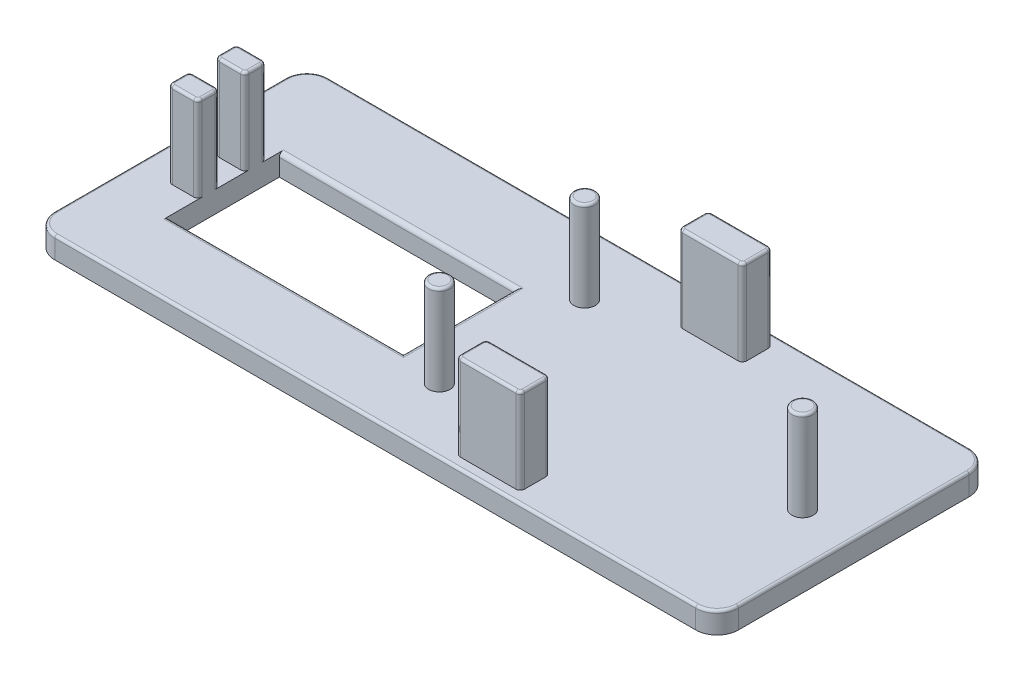
from build123d import *

# Parameters (mm, degrees)
SKETCH3_R             = 1.25
BOSS_EXTRUDE1_DEPTH   = 10.5
BOSS_EXTRUDE1_2_DEPTH = 10.5
BOSS_EXTRUDE1_3_DEPTH = 10.5
BOSS_EXTRUDE2_DEPTH   = 10
BOSS_EXTRUDE2_2_DEPTH = 10
BOSS_EXTRUDE2_3_DEPTH = 10
BOSS_EXTRUDE2_4_DEPTH = 10
BOSS_EXTRUDE3_DEPTH   = 2.5
FILLET1_R             = 0.3
SKETCH9_W             = 27.536120899
SKETCH9_H             = 13
CUT_EXTRUDE1_DEPTH    = 45.342417616
FILLET2_R             = 0.5


with BuildPart() as part:
    # Sketch3 → Boss-Extrude1 (new body)
    with BuildSketch(Plane(origin=(0, 0, 0), x_dir=(1, 0, 0), z_dir=(0, 1, 0))):
        with Locations(Location((0, 8.5, 0), (0, 0, 90))):
            Circle(SKETCH3_R)
    extrude(amount=BOSS_EXTRUDE1_DEPTH)



with BuildPart() as body_2:
    # Sketch3 → Boss-Extrude1 2 (new body)
    with BuildSketch(Plane(origin=(0, 0, 0), x_dir=(1, 0, 0), z_dir=(0, 1, 0))):
        with Locations(Location((0, -8.5, 0), (0, 0, 90))):
            Circle(SKETCH3_R)
    extrude(amount=BOSS_EXTRUDE1_2_DEPTH)


with BuildPart() as body_3:
    # Sketch3 → Boss-Extrude1 3 (new body)
    with BuildSketch(Plane(origin=(0, 0, 0), x_dir=(1, 0, 0), z_dir=(0, 1, 0))):
        with Locations(Location((34, 0, 0), (0, 0, 90))):
            Circle(SKETCH3_R)
    extrude(amount=BOSS_EXTRUDE1_3_DEPTH)


with BuildPart() as body_4:
    # Sketch7 → Boss-Extrude2 (new body)
    with BuildSketch(Plane(origin=(0, 0, 0), x_dir=(1, 0, 0), z_dir=(0, 1, 0))):
        with BuildLine():
            Line((8.713541775, -11.254), (15.213541775, -11.254))
            ThreePointArc((15.213541775, -11.254), (15.567095166, -11.400446609), (15.713541775, -11.754))
            Line((15.713541775, -11.754), (15.713541775, -14.254))
            ThreePointArc((15.713541775, -14.254), (15.567095166, -14.607553391), (15.213541775, -14.754))
            Line((15.213541775, -14.754), (8.713541775, -14.754))
            ThreePointArc((8.713541775, -14.754), (8.359988385, -14.607553391), (8.213541775, -14.254))
            Line((8.213541775, -14.254), (8.213541775, -11.754))
            ThreePointArc((8.213541775, -11.754), (8.359988385, -11.400446609), (8.713541775, -11.254))
        make_face()
    extrude(amount=BOSS_EXTRUDE2_DEPTH)


with BuildPart() as body_5:
    # Sketch7 → Boss-Extrude2 2 (new body)
    with BuildSketch(Plane(origin=(0, 0, 0), x_dir=(1, 0, 0), z_dir=(0, 1, 0))):
        with BuildLine():
            Line((8.713541775, 14.754), (15.213541775, 14.754))
            ThreePointArc((15.213541775, 14.754), (15.567095166, 14.607553391), (15.713541775, 14.254))
            Line((15.713541775, 14.254), (15.713541775, 11.754))
            ThreePointArc((15.713541775, 11.754), (15.567095166, 11.400446609), (15.213541775, 11.254))
            Line((15.213541775, 11.254), (8.713541775, 11.254))
            ThreePointArc((8.713541775, 11.254), (8.359988385, 11.400446609), (8.213541775, 11.754))
            Line((8.213541775, 11.754), (8.213541775, 14.254))
            ThreePointArc((8.213541775, 14.254), (8.359988385, 14.607553391), (8.713541775, 14.754))
        make_face()
    extrude(amount=BOSS_EXTRUDE2_2_DEPTH)


with BuildPart() as body_6:
    # Sketch7 → Boss-Extrude2 3 (new body)
    with BuildSketch(Plane(origin=(0, 0, 0), x_dir=(1, 0, 0), z_dir=(0, 1, 0))):
        with BuildLine():
            Line((-36.254, -3.5), (-36.254, -2))
            ThreePointArc((-36.254, -2), (-36.107553391, -1.646446609), (-35.754, -1.5))
            Line((-35.754, -1.5), (-33.254, -1.5))
            ThreePointArc((-33.254, -1.5), (-32.900446609, -1.646446609), (-32.754, -2))
            Line((-32.754, -2), (-32.754, -3.5))
            ThreePointArc((-32.754, -3.5), (-32.900446609, -3.853553391), (-33.254, -4))
            Line((-33.254, -4), (-35.754, -4))
            ThreePointArc((-35.754, -4), (-36.107553391, -3.853553391), (-36.254, -3.5))
        make_face()
    extrude(amount=BOSS_EXTRUDE2_3_DEPTH)


with BuildPart() as body_7:
    # Sketch7 → Boss-Extrude2 4 (new body)
    with BuildSketch(Plane(origin=(0, 0, 0), x_dir=(1, 0, 0), z_dir=(0, 1, 0))):
        with BuildLine():
            Line((-35.754, 4), (-33.254, 4))
            ThreePointArc((-33.254, 4), (-32.900446609, 3.853553391), (-32.754, 3.5))
            Line((-32.754, 3.5), (-32.754, 2))
            ThreePointArc((-32.754, 2), (-32.900446609, 1.646446609), (-33.254, 1.5))
            Line((-33.254, 1.5), (-35.754, 1.5))
            ThreePointArc((-35.754, 1.5), (-36.107553391, 1.646446609), (-36.254, 2))
            Line((-36.254, 2), (-36.254, 3.5))
            ThreePointArc((-36.254, 3.5), (-36.107553391, 3.853553391), (-35.754, 4))
        make_face()
    extrude(amount=BOSS_EXTRUDE2_4_DEPTH)


with BuildPart() as part_1:
    add(part.part)

    add(body_2.part)  # Boss-Extrude3 merges body 2

    add(body_3.part)  # Boss-Extrude3 merges body 3

    add(body_4.part)  # Boss-Extrude3 merges body 4

    add(body_5.part)  # Boss-Extrude3 merges body 5

    add(body_6.part)  # Boss-Extrude3 merges body 6

    add(body_7.part)  # Boss-Extrude3 merges body 7
    # Sketch8 → Boss-Extrude3 (add)
    with BuildSketch(Plane(origin=(0, 0, 0), x_dir=(1, 0, 0), z_dir=(0, 1, 0))):
        with BuildLine():
            Line((-37.5, -16), (37.5, -16))
            ThreePointArc((37.5, -16), (39.267766953, -15.267766953), (40, -13.5))
            Line((40, -13.5), (40, 13.5))
            ThreePointArc((40, 13.5), (39.267766953, 15.267766953), (37.5, 16))
            Line((37.5, 16), (-37.5, 16))
            ThreePointArc((-37.5, 16), (-39.267766953, 15.267766953), (-40, 13.5))
            Line((-40, 13.5), (-40, -13.5))
            ThreePointArc((-40, -13.5), (-39.267766953, -15.267766953), (-37.5, -16))
        make_face()
    extrude(amount=-BOSS_EXTRUDE3_DEPTH)

    # Fillet1
    fillet1_edges = [part_1.edges().sort_by_distance(p)[0] for p in [
        (-39.267766953, 0, 15.267766953),
        (0, 0, 16),
        (39.267766953, 0, 15.267766953),
        (40, 0, 0),
        (39.267766953, 0, -15.267766953),
        (0, 0, -16),
        (-39.267766953, 0, -15.267766953),
        (-40, 0, 0),
        (0, 10.5, 9.75),
        (34, 10.5, 1.25),
        (15.713541775, 10, 13.004),
        (15.567095166, 10, 11.400446609),
        (11.963541775, 10, 11.254),
        (8.359988385, 10, 11.400446609),
        (8.213541775, 10, 13.004),
        (8.359988385, 10, 14.607553391),
        (11.963541775, 10, 14.754),
        (15.567095166, 10, 14.607553391),
        (0, 10.5, -7.25),
        (11.963541775, 10, -14.754),
        (8.213541775, 10, -13.004),
        (8.359988385, 10, -11.400446609),
        (15.567095166, 10, -11.400446609),
        (15.567095166, 10, -14.607553391),
        (8.359988385, 10, -14.607553391),
        (11.963541775, 10, -11.254),
        (15.713541775, 10, -13.004),
        (-34.504, 10, -4),
        (-32.754, 10, -2.75),
        (-32.900446609, 10, -3.853553391),
        (-36.107553391, 10, -3.853553391),
        (-36.254, 10, -2.75),
        (-36.107553391, 10, -1.646446609),
        (-34.504, 10, -1.5),
        (-32.900446609, 10, -1.646446609),
        (-34.504, 10, 1.5),
        (-36.107553391, 10, 1.646446609),
        (-36.254, 10, 2.75),
        (-32.754, 10, 2.75),
        (-32.900446609, 10, 1.646446609),
        (-36.107553391, 10, 3.853553391),
        (-34.504, 10, 4),
        (-32.900446609, 10, 3.853553391),
    ]]
    fillet(fillet1_edges, radius=FILLET1_R)

    # Sketch9 → Cut-Extrude1 (cut, through all)
    with BuildSketch(Plane(origin=(0, 0, 0), x_dir=(1, 0, 0), z_dir=(0, 1, 0))):
        with Locations((-18.985939551, -0.975617597)):
            Rectangle(SKETCH9_W, SKETCH9_H)
    extrude(amount=-CUT_EXTRUDE1_DEPTH, mode=Mode.SUBTRACT)

    # Fillet2
    fillet2_edges = [part_1.edges().sort_by_distance(p)[0] for p in [
        (-18.985939551, 0, 7.475617597),
        (-5.217879101, 0, 0.975617597),
        (-18.985939551, 0, -5.524382403),
    ]]
    fillet(fillet2_edges, radius=FILLET2_R)


solid = part_1.part
